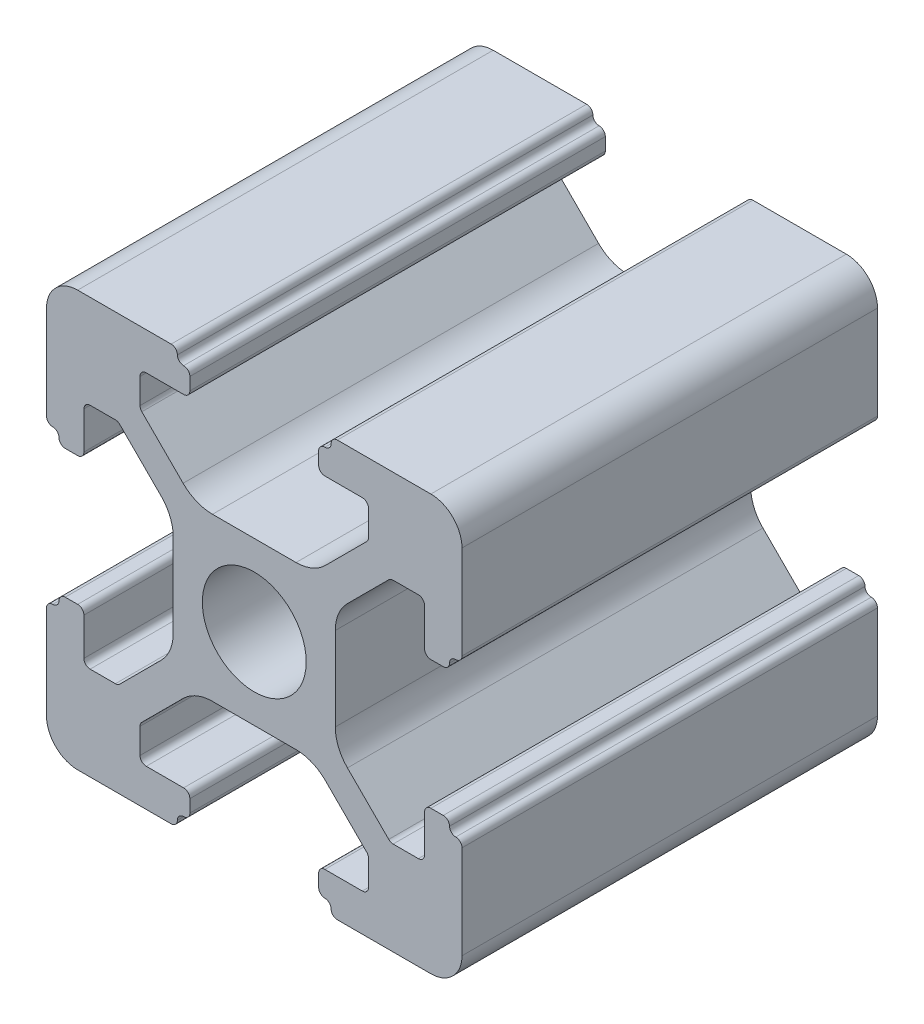
from build123d import *

# Parameters (mm, degrees)
SKETCH_1_R      = 2.5
EXTRUDE_1_DEPTH = 10


with BuildPart() as part:
    # 草图1 → 凸台-拉伸1 (new, symmetric)
    with BuildSketch(Plane.XY):
        with BuildLine():
            Line((10, 8.5), (10, 4))
            ThreePointArc((10, 4), (9.912132034, 3.787867966), (9.7, 3.7))
            ThreePointArc((9.7, 3.7), (9.487867966, 3.612132034), (9.4, 3.4))
            ThreePointArc((9.4, 3.4), (9.312132034, 3.187867966), (9.1, 3.1))
            Line((9.1, 3.1), (8.5, 3.1))
            ThreePointArc((8.5, 3.1), (8.287867966, 3.187867966), (8.2, 3.4))
            Line((8.2, 3.4), (8.2, 5.2))
            ThreePointArc((8.2, 5.2), (8.112132034, 5.412132034), (7.9, 5.5))
            Line((7.9, 5.5), (6.68492424, 5.5))
            ThreePointArc((6.68492424, 5.5), (6.570119211, 5.47716386), (6.472792206, 5.412132034))
            Line((6.472792206, 5.412132034), (4.485786438, 3.425126266))
            ThreePointArc((4.485786438, 3.425126266), (4.052240935, 2.776279568), (3.9, 2.010912703))
            Line((3.9, 2.010912703), (3.9, -2.010912703))
            ThreePointArc((3.9, -2.010912703), (4.052240935, -2.776279568), (4.485786438, -3.425126266))
            Line((4.485786438, -3.425126266), (6.472792206, -5.412132034))
            ThreePointArc((6.472792206, -5.412132034), (6.570119211, -5.47716386), (6.68492424, -5.5))
            Line((6.68492424, -5.5), (7.9, -5.5))
            ThreePointArc((7.9, -5.5), (8.112132034, -5.412132034), (8.2, -5.2))
            Line((8.2, -5.2), (8.2, -3.4))
            ThreePointArc((8.2, -3.4), (8.287867966, -3.187867966), (8.5, -3.1))
            Line((8.5, -3.1), (9.1, -3.1))
            ThreePointArc((9.1, -3.1), (9.312132034, -3.187867966), (9.4, -3.4))
            ThreePointArc((9.4, -3.4), (9.487867966, -3.612132034), (9.7, -3.7))
            ThreePointArc((9.7, -3.7), (9.912132034, -3.787867966), (10, -4))
            Line((10, -4), (10, -8.5))
            ThreePointArc((10, -8.5), (9.560660172, -9.560660172), (8.5, -10))
            Line((8.5, -10), (4, -10))
            ThreePointArc((4, -10), (3.787867966, -9.912132034), (3.7, -9.7))
            ThreePointArc((3.7, -9.7), (3.612132034, -9.487867966), (3.4, -9.4))
            ThreePointArc((3.4, -9.4), (3.187867966, -9.312132034), (3.1, -9.1))
            Line((3.1, -9.1), (3.1, -8.5))
            ThreePointArc((3.1, -8.5), (3.187867966, -8.287867966), (3.4, -8.2))
            Line((3.4, -8.2), (5.2, -8.2))
            ThreePointArc((5.2, -8.2), (5.412132034, -8.112132034), (5.5, -7.9))
            Line((5.5, -7.9), (5.5, -6.68492424))
            ThreePointArc((5.5, -6.68492424), (5.47716386, -6.570119211), (5.412132034, -6.472792206))
            Line((5.412132034, -6.472792206), (3.425126266, -4.485786438))
            ThreePointArc((3.425126266, -4.485786438), (2.776279568, -4.052240935), (2.010912703, -3.9))
            Line((2.010912703, -3.9), (-2.010912703, -3.9))
            ThreePointArc((-2.010912703, -3.9), (-2.776279568, -4.052240935), (-3.425126266, -4.485786438))
            Line((-3.425126266, -4.485786438), (-5.412132034, -6.472792206))
            ThreePointArc((-5.412132034, -6.472792206), (-5.47716386, -6.570119211), (-5.5, -6.68492424))
            Line((-5.5, -6.68492424), (-5.5, -7.9))
            ThreePointArc((-5.5, -7.9), (-5.412132034, -8.112132034), (-5.2, -8.2))
            Line((-5.2, -8.2), (-3.4, -8.2))
            ThreePointArc((-3.4, -8.2), (-3.187867966, -8.287867966), (-3.1, -8.5))
            Line((-3.1, -8.5), (-3.1, -9.1))
            ThreePointArc((-3.1, -9.1), (-3.187867966, -9.312132034), (-3.4, -9.4))
            ThreePointArc((-3.4, -9.4), (-3.612132034, -9.487867966), (-3.7, -9.7))
            ThreePointArc((-3.7, -9.7), (-3.787867966, -9.912132034), (-4, -10))
            Line((-4, -10), (-8.5, -10))
            ThreePointArc((-8.5, -10), (-9.560660172, -9.560660172), (-10, -8.5))
            Line((-10, -8.5), (-10, -4))
            ThreePointArc((-10, -4), (-9.912132034, -3.787867966), (-9.7, -3.7))
            ThreePointArc((-9.7, -3.7), (-9.487867966, -3.612132034), (-9.4, -3.4))
            ThreePointArc((-9.4, -3.4), (-9.312132034, -3.187867966), (-9.1, -3.1))
            Line((-9.1, -3.1), (-8.5, -3.1))
            ThreePointArc((-8.5, -3.1), (-8.287867966, -3.187867966), (-8.2, -3.4))
            Line((-8.2, -3.4), (-8.2, -5.2))
            ThreePointArc((-8.2, -5.2), (-8.112132034, -5.412132034), (-7.9, -5.5))
            Line((-7.9, -5.5), (-6.68492424, -5.5))
            ThreePointArc((-6.68492424, -5.5), (-6.570119211, -5.47716386), (-6.472792206, -5.412132034))
            Line((-6.472792206, -5.412132034), (-4.485786438, -3.425126266))
            ThreePointArc((-4.485786438, -3.425126266), (-4.052240935, -2.776279568), (-3.9, -2.010912703))
            Line((-3.9, -2.010912703), (-3.9, 2.010912703))
            ThreePointArc((-3.9, 2.010912703), (-4.052240935, 2.776279568), (-4.485786438, 3.425126266))
            Line((-4.485786438, 3.425126266), (-6.472792206, 5.412132034))
            ThreePointArc((-6.472792206, 5.412132034), (-6.570119211, 5.47716386), (-6.68492424, 5.5))
            Line((-6.68492424, 5.5), (-7.9, 5.5))
            ThreePointArc((-7.9, 5.5), (-8.112132034, 5.412132034), (-8.2, 5.2))
            Line((-8.2, 5.2), (-8.2, 3.4))
            ThreePointArc((-8.2, 3.4), (-8.287867966, 3.187867966), (-8.5, 3.1))
            Line((-8.5, 3.1), (-9.1, 3.1))
            ThreePointArc((-9.1, 3.1), (-9.312132034, 3.187867966), (-9.4, 3.4))
            ThreePointArc((-9.4, 3.4), (-9.487867966, 3.612132034), (-9.7, 3.7))
            ThreePointArc((-9.7, 3.7), (-9.912132034, 3.787867966), (-10, 4))
            Line((-10, 4), (-10, 8.5))
            ThreePointArc((-10, 8.5), (-9.560660172, 9.560660172), (-8.5, 10))
            Line((-8.5, 10), (-4, 10))
            ThreePointArc((-4, 10), (-3.787867966, 9.912132034), (-3.7, 9.7))
            ThreePointArc((-3.7, 9.7), (-3.612132034, 9.487867966), (-3.4, 9.4))
            ThreePointArc((-3.4, 9.4), (-3.187867966, 9.312132034), (-3.1, 9.1))
            Line((-3.1, 9.1), (-3.1, 8.5))
            ThreePointArc((-3.1, 8.5), (-3.187867966, 8.287867966), (-3.4, 8.2))
            Line((-3.4, 8.2), (-5.2, 8.2))
            ThreePointArc((-5.2, 8.2), (-5.412132034, 8.112132034), (-5.5, 7.9))
            Line((-5.5, 7.9), (-5.5, 6.68492424))
            ThreePointArc((-5.5, 6.68492424), (-5.47716386, 6.570119211), (-5.412132034, 6.472792206))
            Line((-5.412132034, 6.472792206), (-3.425126266, 4.485786438))
            ThreePointArc((-3.425126266, 4.485786438), (-2.776279568, 4.052240935), (-2.010912703, 3.9))
            Line((-2.010912703, 3.9), (2.010912703, 3.9))
            ThreePointArc((2.010912703, 3.9), (2.776279568, 4.052240935), (3.425126266, 4.485786438))
            Line((3.425126266, 4.485786438), (5.412132034, 6.472792206))
            ThreePointArc((5.412132034, 6.472792206), (5.47716386, 6.570119211), (5.5, 6.68492424))
            Line((5.5, 6.68492424), (5.5, 7.9))
            ThreePointArc((5.5, 7.9), (5.412132034, 8.112132034), (5.2, 8.2))
            Line((5.2, 8.2), (3.4, 8.2))
            ThreePointArc((3.4, 8.2), (3.187867966, 8.287867966), (3.1, 8.5))
            Line((3.1, 8.5), (3.1, 9.1))
            ThreePointArc((3.1, 9.1), (3.187867966, 9.312132034), (3.4, 9.4))
            ThreePointArc((3.4, 9.4), (3.612132034, 9.487867966), (3.7, 9.7))
            ThreePointArc((3.7, 9.7), (3.787867966, 9.912132034), (4, 10))
            Line((4, 10), (8.5, 10))
            ThreePointArc((8.5, 10), (9.560660172, 9.560660172), (10, 8.5))
        make_face()
        Circle(SKETCH_1_R, mode=Mode.SUBTRACT)
    extrude(amount=EXTRUDE_1_DEPTH, both=True)


solid = part.part
